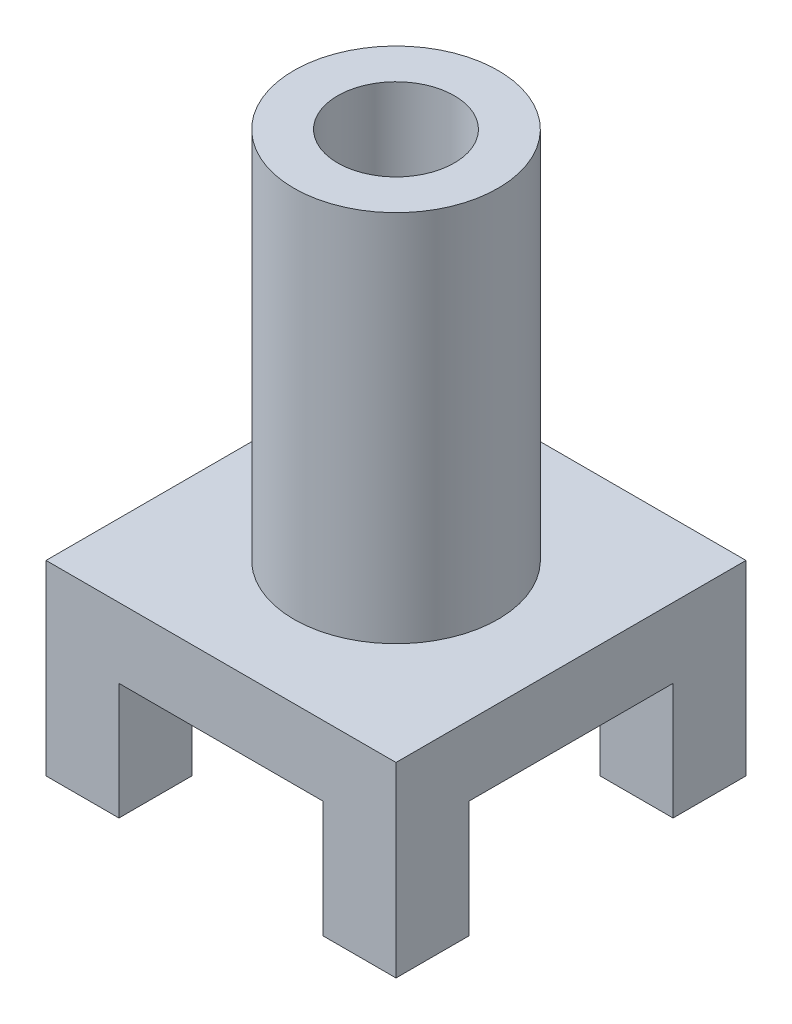
from build123d import *

# Parameters (mm, degrees)
CROQUIS1_W              = 60
CROQUIS1_H              = 60
SALIENTE_EXTRUIR1_DEPTH = 32
CROQUIS2_W              = 35
CROQUIS2_H              = 20
CORTAR_EXTRUIR1_DEPTH   = 75.323616704
CROQUIS3_W              = 35
CROQUIS3_H              = 20
CORTAR_EXTRUIR2_DEPTH   = 75.323616704
CROQUIS4_R              = 17.5
SALIENTE_EXTRUIR2_DEPTH = 64
CROQUIS5_R              = 10
CORTAR_EXTRUIR3_DEPTH   = 105.957134107


with BuildPart() as part:
    # Croquis1 → Saliente-Extruir1 (new body)
    with BuildSketch(Plane(origin=(0, 0, 0), x_dir=(1, 0, 0), z_dir=(0, 1, 0))):
        Rectangle(CROQUIS1_W, CROQUIS1_H)
    extrude(amount=SALIENTE_EXTRUIR1_DEPTH)

    # Croquis2 → Cortar-Extruir1 (cut, through all)
    with BuildSketch(Plane.XY.offset(30)):
        with Locations((0, 10)):
            Rectangle(CROQUIS2_W, CROQUIS2_H)
    extrude(amount=-CORTAR_EXTRUIR1_DEPTH, mode=Mode.SUBTRACT)

    # Croquis3 → Cortar-Extruir2 (cut, through all)
    with BuildSketch(Plane(origin=(30, 0, 0), x_dir=(0, 0, -1), z_dir=(1, 0, 0))):
        with Locations((0, 10)):
            Rectangle(CROQUIS3_W, CROQUIS3_H)
    extrude(amount=-CORTAR_EXTRUIR2_DEPTH, mode=Mode.SUBTRACT)

    # Croquis4 → Saliente-Extruir2 (add)
    with BuildSketch(Plane(origin=(0, 32, 0), x_dir=(1, 0, 0), z_dir=(0, 1, 0))):
        with Locations(Location((0, 0, 0), (0, 0, 270))):
            Circle(CROQUIS4_R)
    extrude(amount=SALIENTE_EXTRUIR2_DEPTH)

    # Croquis5 → Cortar-Extruir3 (cut, through all)
    with BuildSketch(Plane(origin=(0, 96, 0), x_dir=(1, 0, 0), z_dir=(0, 1, 0))):
        with Locations(Location((0, 0, 0), (0, 0, 270))):
            Circle(CROQUIS5_R)
    extrude(amount=-CORTAR_EXTRUIR3_DEPTH, mode=Mode.SUBTRACT)


solid = part.part
